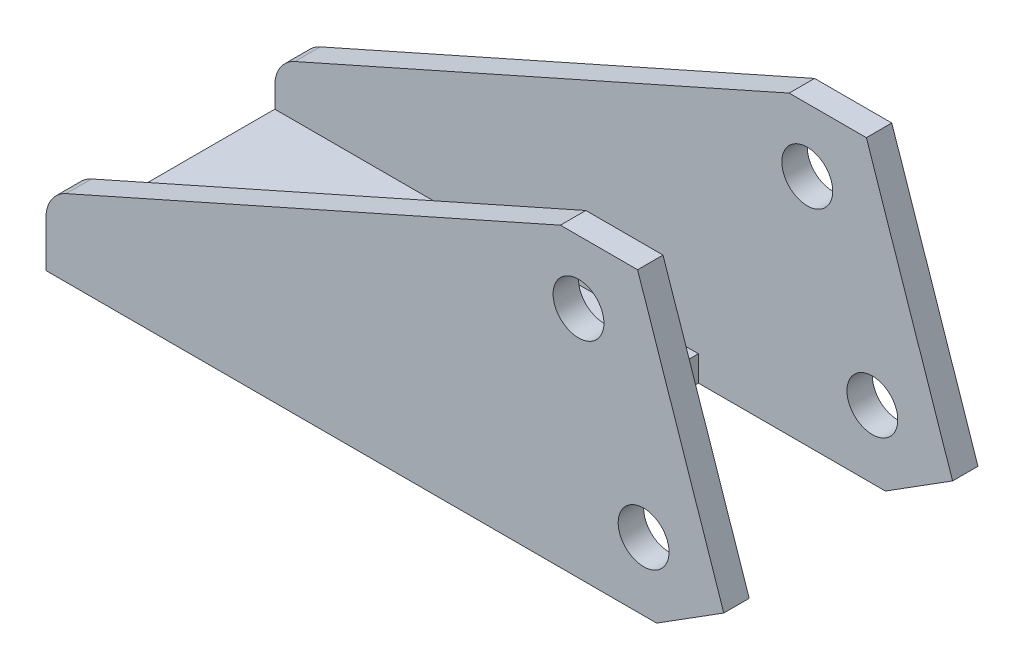
from build123d import *

# Parameters (mm, degrees)
SKETCH_1_R          = 1.5
EXTRUDE_1_DEPTH     = 15
SKETCH_2_W          = 21.498069498
SKETCH_2_H          = 12
CUT_EXTRUDE_1_DEPTH = 50
SKETCH_3_W          = 12
SKETCH_3_H          = 16
CUT_EXTRUDE_2_DEPTH = 50
SKETCH_4_R          = 1.5
CUT_EXTRUDE_3_DEPTH = 50


with BuildPart() as part:
    # Эскиз1 → Вытянуть1 (new body)
    with BuildSketch(Plane.XY):
        with BuildLine():
            Line((1.187295832, 4.528019462), (30.355876768, 17.5))
            Line((30.355876768, 17.5), (34.911631679, 17.5))
            Line((34.911631679, 17.5), (40, 2.498964042))
            Line((40, 2.498964042), (36.034968506, 0))
            Line((36.034968506, 0), (0, 0))
            Line((0, 0), (0, 2.700586308))
            ThreePointArc((0, 2.700586308), (0.322888147, 3.790217361), (1.187295832, 4.528019462))
        make_face()
        with Locations((35.266995766, 4)):
            Circle(SKETCH_1_R, mode=Mode.SUBTRACT)
        with Locations((31.42446315, 13.771639734)):
            Circle(SKETCH_1_R, mode=Mode.SUBTRACT)
    extrude(amount=EXTRUDE_1_DEPTH)

    # Эскиз2 → Вырез-Вытянуть1 (cut)
    with BuildSketch(Plane.XZ):
        with Locations((35.749034749, 7.5)):
            Rectangle(SKETCH_2_W, SKETCH_2_H)
    extrude(amount=-CUT_EXTRUDE_1_DEPTH, mode=Mode.SUBTRACT)

    # Эскиз3 → Вырез-Вытянуть2 (cut)
    with BuildSketch(Plane(origin=(25, 0, 0), x_dir=(0, 0, -1), z_dir=(1, 0, 0))):
        with Locations((-7.5, 9.5)):
            Rectangle(SKETCH_3_W, SKETCH_3_H)
    extrude(amount=-CUT_EXTRUDE_2_DEPTH, mode=Mode.SUBTRACT)

    # Эскиз4 → Вырез-Вытянуть3 (cut)
    with BuildSketch(Plane.XZ):
        with Locations(Location((8, 7.5, 0), (0, 0, 270))):
            Circle(SKETCH_4_R)
        with Locations(Location((20, 7.5, 0), (0, 0, 270))):
            Circle(SKETCH_4_R)
    extrude(amount=-CUT_EXTRUDE_3_DEPTH, mode=Mode.SUBTRACT)


solid = part.part
